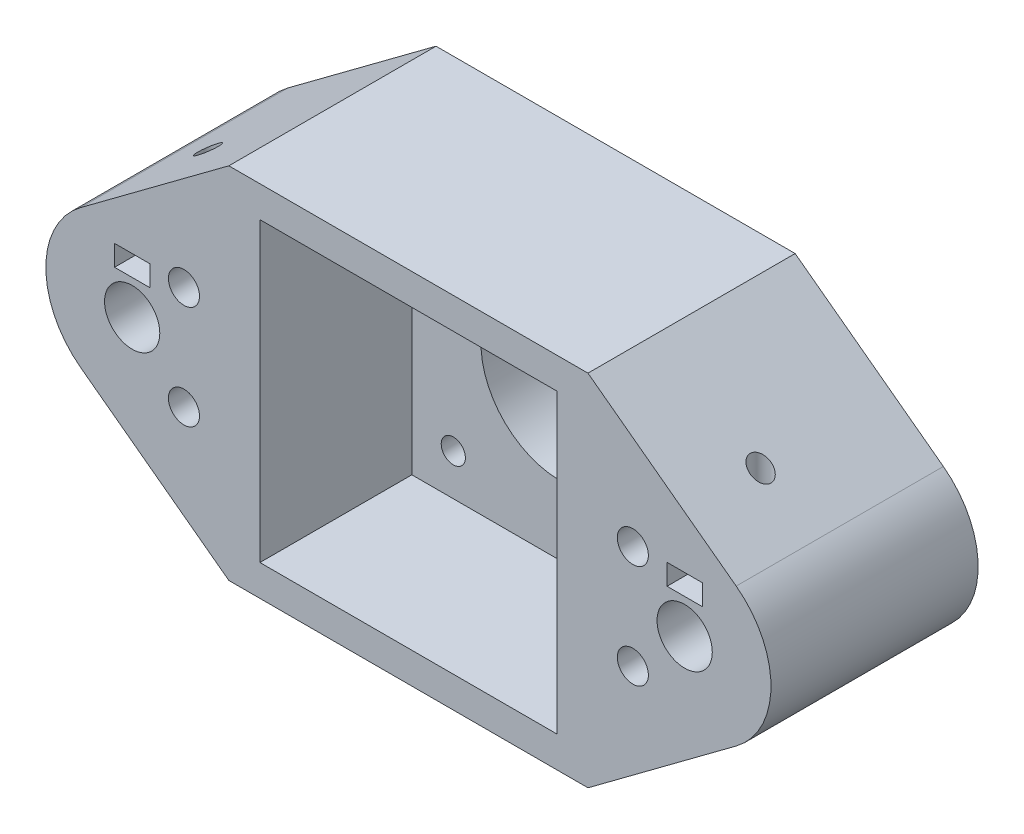
from build123d import *

# Parameters (mm, degrees)
ESBO_O1_R                  = 1.75
ESBO_O1_R_2                = 11.5
ESBO_O1_R_3                = 4
ESBO_O1_R_4                = 2.25
RESSALTO_EXTRUS_O1_DEPTH   = 30
ESBO_O2_W                  = 43
ESBO_O2_H                  = 43
ESBO_O2_W_2                = 5.1
ESBO_O2_H_2                = 3
CORTE_EXTRUS_O1_DEPTH      = 22
ESBO_O3_R                  = 4.5
CORTE_EXTRUS_O2_DEPTH      = 3
CORTE_EXTRUS_O3_DEPTH      = 68.950349521
CORTE_EXTRUS_O3_DEPTH_BACK = 3
ESBO_O4_R                  = 1.5


with BuildPart() as part:
    # Esboço1 → Ressalto-extrusão1 (new body)
    with BuildSketch(Plane.XY):
        with BuildLine():
            Line((-26, 26), (26, 26))
            Line((26, 26), (47.462602, 10.027939539))
            ThreePointArc((47.462602, 10.027939539), (52.5, 0), (47.462602, -10.027939539))
            Line((47.462602, -10.027939539), (26, -26))
            Line((26, -26), (-26, -26))
            Line((-26, -26), (-47.462602, -10.027939539))
            ThreePointArc((-47.462602, -10.027939539), (-52.5, 0), (-47.462602, 10.027939539))
            Line((-47.462602, 10.027939539), (-26, 26))
        make_face()
        with Locations((-15.5, 15.5)):
            Circle(ESBO_O1_R, mode=Mode.SUBTRACT)
        with Locations((15.5, 15.5)):
            Circle(ESBO_O1_R, mode=Mode.SUBTRACT)
        with Locations((15.5, -15.5)):
            Circle(ESBO_O1_R, mode=Mode.SUBTRACT)
        with Locations((-15.5, -15.5)):
            Circle(ESBO_O1_R, mode=Mode.SUBTRACT)
        Circle(ESBO_O1_R_2, mode=Mode.SUBTRACT)
        with Locations((-40, 0)):
            Circle(ESBO_O1_R_3, mode=Mode.SUBTRACT)
        with Locations((40, 0)):
            Circle(ESBO_O1_R_3, mode=Mode.SUBTRACT)
        with Locations((-32.5, 7.5)):
            Circle(ESBO_O1_R_4, mode=Mode.SUBTRACT)
        with Locations((-32.5, -7.5)):
            Circle(ESBO_O1_R_4, mode=Mode.SUBTRACT)
        with Locations(Location((32.5, -7.5, 0), (0, 0, 180))):
            Circle(ESBO_O1_R_4, mode=Mode.SUBTRACT)
        with Locations(Location((32.5, 7.5, 0), (0, 0, 180))):
            Circle(ESBO_O1_R_4, mode=Mode.SUBTRACT)
    extrude(amount=RESSALTO_EXTRUS_O1_DEPTH)

    # Esboço2 → Corte-extrusão1 (cut)
    with BuildSketch(Plane.XY.offset(30)):
        Rectangle(ESBO_O2_W, ESBO_O2_H)
        with Locations((-40, 6.5)):
            Rectangle(ESBO_O2_W_2, ESBO_O2_H_2)
        with Locations((40, 6.5)):
            Rectangle(ESBO_O2_W_2, ESBO_O2_H_2)
    extrude(amount=-CORTE_EXTRUS_O1_DEPTH, mode=Mode.SUBTRACT)

    # Esboço3 → Corte-extrusão2 (cut)
    with BuildSketch(Plane(origin=(0, 0, 0), x_dir=(-1, 0, 0), z_dir=(0, 0, -1))):
        with Locations((-15.5, 15.5)):
            Circle(ESBO_O3_R)
        with Locations((15.5, 15.5)):
            Circle(ESBO_O3_R)
        with Locations((-15.5, -15.5)):
            Circle(ESBO_O3_R)
        with Locations((15.5, -15.5)):
            Circle(ESBO_O3_R)
    extrude(amount=-CORTE_EXTRUS_O2_DEPTH, mode=Mode.SUBTRACT)

    # Esboço4 → Corte-extrusão3 (cut, two sides: drawn at the far end of the back side and taken through both)
    with BuildSketch(Plane(origin=(0, 5, 0), x_dir=(1, 0, 0), z_dir=(0, 1, 0)).offset(-CORTE_EXTRUS_O3_DEPTH_BACK)):
        with Locations(Location((-40, -19, 0), (0, 0, 180))):
            Circle(ESBO_O4_R)
        with Locations((40, -19)):
            Circle(ESBO_O4_R)
    extrude(amount=CORTE_EXTRUS_O3_DEPTH + CORTE_EXTRUS_O3_DEPTH_BACK, mode=Mode.SUBTRACT)


solid = part.part
